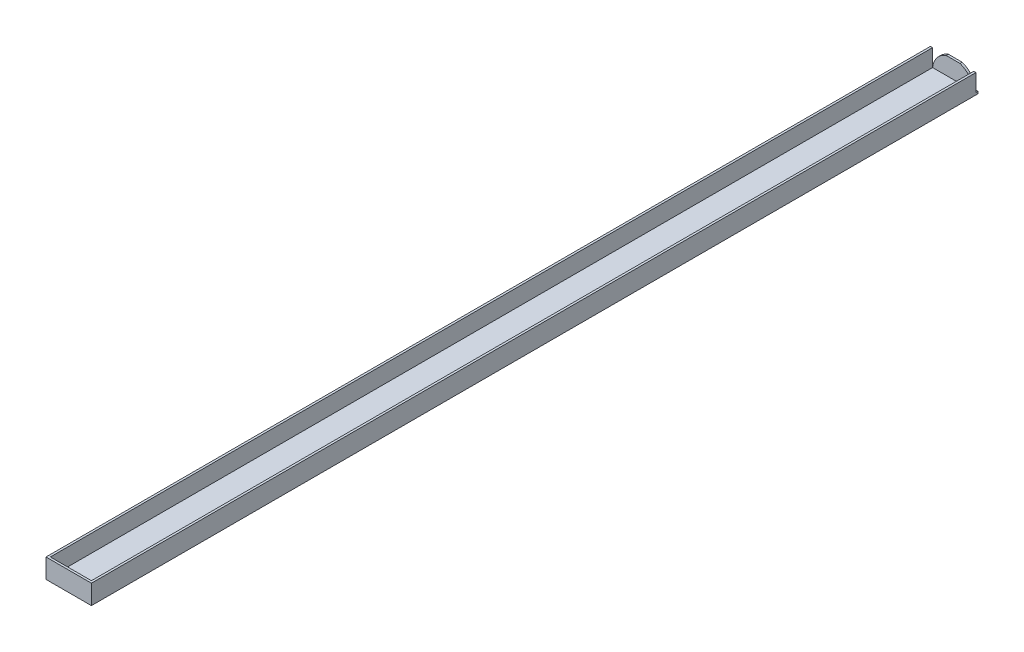
from build123d import *

# Parameters (mm, degrees)
SKETCH1_W           = 21
SKETCH1_H           = 9
BOSS_EXTRUDE1_DEPTH = 410
SKETCH2_W           = 19
SKETCH2_H           = 408
CUT_EXTRUDE1_DEPTH  = 8
CUT_EXTRUDE2_DEPTH  = 8
SKETCH5_W           = 1
SKETCH5_H           = 8
CUT_EXTRUDE3_DEPTH  = 1
SKETCH6_W           = 1
SKETCH6_H           = 8
CUT_EXTRUDE4_DEPTH  = 1


with BuildPart() as part:
    # Sketch1 → Boss-Extrude1 (new body)
    with BuildSketch(Plane.XY):
        with Locations((10.5, -4.5)):
            Rectangle(SKETCH1_W, SKETCH1_H)
    extrude(amount=BOSS_EXTRUDE1_DEPTH)

    # Sketch2 → Cut-Extrude1 (cut)
    with BuildSketch(Plane(origin=(0, 0, 0), x_dir=(1, 0, 0), z_dir=(0, 1, 0))):
        with Locations((10.5, -205)):
            Rectangle(SKETCH2_W, SKETCH2_H)
    extrude(amount=-CUT_EXTRUDE1_DEPTH, mode=Mode.SUBTRACT)

    # Sketch4 → Cut-Extrude2 (cut)
    with BuildSketch(Plane(origin=(0, 0, 0), x_dir=(-1, 0, 0), z_dir=(0, 0, -1))):
        with BuildLine():
            Line((-20, -8.061503552), (-20, 0))
            Line((-20, 0), (-13.682887931, 0))
            ThreePointArc((-13.682887931, 0), (-18.014044946, -3.111884501), (-20, -8.061503552))
        make_face()
        with BuildLine():
            Line((-1, 0), (-7.317112069, 0))
            ThreePointArc((-7.317112069, 0), (-2.985955054, -3.111884501), (-1, -8.061503552))
            Line((-1, -8.061503552), (-1, 0))
        make_face()
    extrude(amount=-CUT_EXTRUDE2_DEPTH, mode=Mode.SUBTRACT)

    # Sketch5 → Cut-Extrude3 (cut)
    with BuildSketch(Plane(origin=(21, 0, 0), x_dir=(0, 0, -1), z_dir=(1, 0, 0))):
        with Locations((-0.5, -4)):
            Rectangle(SKETCH5_W, SKETCH5_H)
    extrude(amount=-CUT_EXTRUDE3_DEPTH, mode=Mode.SUBTRACT)

    # Sketch6 → Cut-Extrude4 (cut)
    with BuildSketch(Plane.ZY):
        with Locations((0.5, -4)):
            Rectangle(SKETCH6_W, SKETCH6_H)
    extrude(amount=-CUT_EXTRUDE4_DEPTH, mode=Mode.SUBTRACT)


solid = part.part
